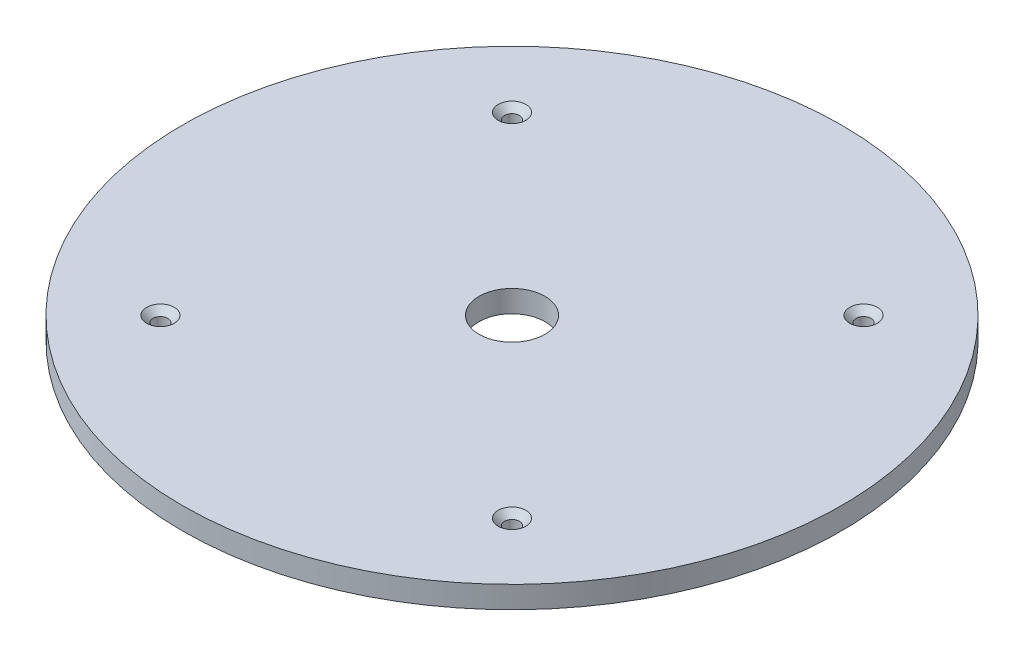
from build123d import *

# Parameters (mm, degrees)
SKETCH1_R                                           = 75
BOSS_EXTRUDE1_DEPTH                                 = 5
CSK_FOR_M3_COUNTERSUNK_FLAT_HEAD_SCREW1_D           = 3.4
CSK_FOR_M3_COUNTERSUNK_FLAT_HEAD_SCREW1_CSINK_D     = 6.3
CSK_FOR_M3_COUNTERSUNK_FLAT_HEAD_SCREW1_CSINK_ANGLE = 90
SKETCH5_R                                           = 7.5
CUT_EXTRUDE1_DEPTH                                  = 107.183802908


with BuildPart() as part:
    # Sketch1 → Boss-Extrude1 (new body)
    with BuildSketch(Plane(origin=(0, 0, 0), x_dir=(1, 0, 0), z_dir=(0, 1, 0))):
        with Locations(Location((0, 0, 0), (0, 0, 270))):
            Circle(SKETCH1_R)
    extrude(amount=BOSS_EXTRUDE1_DEPTH)

    # CSK for M3 Countersunk Flat Head Screw1 (through all)
    with Locations(Plane(origin=(0, 5, 0), x_dir=(1, 0, 0), z_dir=(0, 1, 0))):
        with Locations((-40, 40), (40, 40), (40, -40), (-40, -40)):
            CounterSinkHole(CSK_FOR_M3_COUNTERSUNK_FLAT_HEAD_SCREW1_D / 2, CSK_FOR_M3_COUNTERSUNK_FLAT_HEAD_SCREW1_CSINK_D / 2, counter_sink_angle=CSK_FOR_M3_COUNTERSUNK_FLAT_HEAD_SCREW1_CSINK_ANGLE)

    # Sketch5 → Cut-Extrude1 (cut, through all)
    with BuildSketch(Plane(origin=(0, 5, 0), x_dir=(1, 0, 0), z_dir=(0, 1, 0))):
        with Locations(Location((0, 0, 0), (0, 0, 270))):
            Circle(SKETCH5_R)
    extrude(amount=-CUT_EXTRUDE1_DEPTH, mode=Mode.SUBTRACT)


solid = part.part
